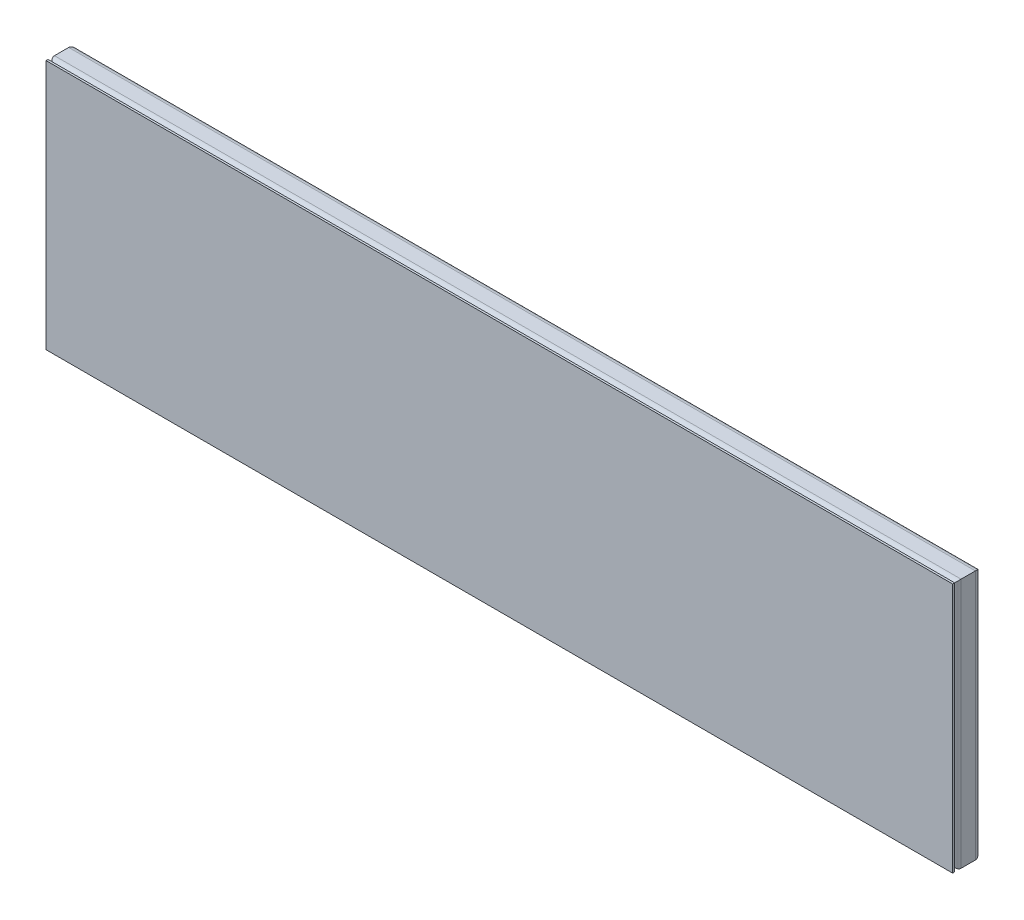
from build123d import *

# Parameters (mm, degrees)
TUBO_CUADRADO_2_X_2_X_0_25_1_DEPTH      = 221.121024484
TUBO_CUADRADO_2_X_2_X_0_25_1_DEPTH_BACK = 36.921024484
TUBO_CUADRADO_2_X_2_X_0_25_1_2_DEPTH    = 873.842048969
TUBO_CUADRADO_2_X_2_X_0_25_1_3_DEPTH    = 258.042048969
TUBO_CUADRADO_2_X_2_X_0_25_1_4_DEPTH    = 873.842048969
CROQUIS3_W                              = 850.8
CROQUIS3_H                              = 235
SALIENTE_EXTRUIR1_DEPTH                 = 1.9


with BuildPart() as part:
    # Sketch1 → Tubo cuadrado 2 X 2 X 0.25(1) (new, two sides: drawn at the far end of the back side and taken through both)
    with BuildSketch(Plane(origin=(-412.7, 92.1, 12.7), x_dir=(1, 0, 0), z_dir=(0, -1, 0)).offset(-TUBO_CUADRADO_2_X_2_X_0_25_1_DEPTH_BACK)):
        with BuildLine():
            Line((-6.7, -12.7), (6.7, -12.7))
            ThreePointArc((6.7, -12.7), (10.942640687, -10.942640687), (12.7, -6.7))
            Line((12.7, -6.7), (12.7, 6.7))
            ThreePointArc((12.7, 6.7), (10.942640687, 10.942640687), (6.7, 12.7))
            Line((6.7, 12.7), (-6.7, 12.7))
            ThreePointArc((-6.7, 12.7), (-10.942640687, 10.942640687), (-12.7, 6.7))
            Line((-12.7, 6.7), (-12.7, -6.7))
            ThreePointArc((-12.7, -6.7), (-10.942640687, -10.942640687), (-6.7, -12.7))
        make_face()
        with BuildLine():
            Line((-6.7, -9.7), (6.7, -9.7))
            ThreePointArc((6.7, -9.7), (8.821320344, -8.821320344), (9.7, -6.7))
            Line((9.7, -6.7), (9.7, 6.7))
            ThreePointArc((9.7, 6.7), (8.821320344, 8.821320344), (6.7, 9.7))
            Line((6.7, 9.7), (-6.7, 9.7))
            ThreePointArc((-6.7, 9.7), (-8.821320344, 8.821320344), (-9.7, 6.7))
            Line((-9.7, 6.7), (-9.7, -6.7))
            ThreePointArc((-9.7, -6.7), (-8.821320344, -8.821320344), (-6.7, -9.7))
        make_face(mode=Mode.SUBTRACT)
    extrude(amount=TUBO_CUADRADO_2_X_2_X_0_25_1_DEPTH + TUBO_CUADRADO_2_X_2_X_0_25_1_DEPTH_BACK)

    # Tubo cuadrado 2 X 2 X 0.25(1) mitre 1
    split(bisect_by=Plane(origin=(-400, 92.1, 0), x_dir=(0.707106781, -0.707106781, 0), z_dir=(-0.707106781, -0.707106781, 0)), keep=Keep.TOP)

    # Tubo cuadrado 2 X 2 X 0.25(1) mitre 2
    split(bisect_by=Plane(origin=(-400, -92.1, 0), x_dir=(-0.707106781, -0.707106781, 0), z_dir=(-0.707106781, 0.707106781, 0)), keep=Keep.TOP)


with BuildPart() as body_2:
    # Sketch1 on segment 2 (carried to segment 2) → Tubo cuadrado 2 X 2 X 0.25_1 2 (new body)
    with BuildSketch(Plane(origin=(-436.921024484, -104.8, 12.7), x_dir=(0, 1, 0), z_dir=(1, 0, 0))):
        with BuildLine():
            Line((-6.7, -12.7), (6.7, -12.7))
            ThreePointArc((6.7, -12.7), (10.942640687, -10.942640687), (12.7, -6.7))
            Line((12.7, -6.7), (12.7, 6.7))
            ThreePointArc((12.7, 6.7), (10.942640687, 10.942640687), (6.7, 12.7))
            Line((6.7, 12.7), (-6.7, 12.7))
            ThreePointArc((-6.7, 12.7), (-10.942640687, 10.942640687), (-12.7, 6.7))
            Line((-12.7, 6.7), (-12.7, -6.7))
            ThreePointArc((-12.7, -6.7), (-10.942640687, -10.942640687), (-6.7, -12.7))
        make_face()
        with BuildLine():
            Line((-6.7, -9.7), (6.7, -9.7))
            ThreePointArc((6.7, -9.7), (8.821320344, -8.821320344), (9.7, -6.7))
            Line((9.7, -6.7), (9.7, 6.7))
            ThreePointArc((9.7, 6.7), (8.821320344, 8.821320344), (6.7, 9.7))
            Line((6.7, 9.7), (-6.7, 9.7))
            ThreePointArc((-6.7, 9.7), (-8.821320344, 8.821320344), (-9.7, 6.7))
            Line((-9.7, 6.7), (-9.7, -6.7))
            ThreePointArc((-9.7, -6.7), (-8.821320344, -8.821320344), (-6.7, -9.7))
        make_face(mode=Mode.SUBTRACT)
    extrude(amount=TUBO_CUADRADO_2_X_2_X_0_25_1_2_DEPTH)

    # Tubo cuadrado 2 X 2 X 0.25_1 2 mitre 1
    split(bisect_by=Plane(origin=(-400, -92.1, 0), x_dir=(0.707106781, 0.707106781, 0), z_dir=(0.707106781, -0.707106781, 0)), keep=Keep.TOP)

    # Tubo cuadrado 2 X 2 X 0.25_1 2 mitre 2
    split(bisect_by=Plane(origin=(400, -92.1, 0), x_dir=(0.707106781, -0.707106781, 0), z_dir=(-0.707106781, -0.707106781, 0)), keep=Keep.TOP)


with BuildPart() as body_3:
    # Sketch1 on segment 3 (carried to segment 3) → Tubo cuadrado 2 X 2 X 0.25_1 3 (new body)
    with BuildSketch(Plane(origin=(412.7, -129.021024484, 12.7), x_dir=(-1, 0, 0), z_dir=(0, 1, 0))):
        with BuildLine():
            Line((-6.7, -12.7), (6.7, -12.7))
            ThreePointArc((6.7, -12.7), (10.942640687, -10.942640687), (12.7, -6.7))
            Line((12.7, -6.7), (12.7, 6.7))
            ThreePointArc((12.7, 6.7), (10.942640687, 10.942640687), (6.7, 12.7))
            Line((6.7, 12.7), (-6.7, 12.7))
            ThreePointArc((-6.7, 12.7), (-10.942640687, 10.942640687), (-12.7, 6.7))
            Line((-12.7, 6.7), (-12.7, -6.7))
            ThreePointArc((-12.7, -6.7), (-10.942640687, -10.942640687), (-6.7, -12.7))
        make_face()
        with BuildLine():
            Line((-6.7, -9.7), (6.7, -9.7))
            ThreePointArc((6.7, -9.7), (8.821320344, -8.821320344), (9.7, -6.7))
            Line((9.7, -6.7), (9.7, 6.7))
            ThreePointArc((9.7, 6.7), (8.821320344, 8.821320344), (6.7, 9.7))
            Line((6.7, 9.7), (-6.7, 9.7))
            ThreePointArc((-6.7, 9.7), (-8.821320344, 8.821320344), (-9.7, 6.7))
            Line((-9.7, 6.7), (-9.7, -6.7))
            ThreePointArc((-9.7, -6.7), (-8.821320344, -8.821320344), (-6.7, -9.7))
        make_face(mode=Mode.SUBTRACT)
    extrude(amount=TUBO_CUADRADO_2_X_2_X_0_25_1_3_DEPTH)

    # Tubo cuadrado 2 X 2 X 0.25_1 3 mitre 1
    split(bisect_by=Plane(origin=(400, 92.1, 0), x_dir=(0.707106781, 0.707106781, 0), z_dir=(0.707106781, -0.707106781, 0)), keep=Keep.TOP)

    # Tubo cuadrado 2 X 2 X 0.25_1 3 mitre 2
    split(bisect_by=Plane(origin=(400, -92.1, 0), x_dir=(-0.707106781, 0.707106781, 0), z_dir=(0.707106781, 0.707106781, 0)), keep=Keep.TOP)


with BuildPart() as body_4:
    # Sketch1 on segment 4 (carried to segment 4) → Tubo cuadrado 2 X 2 X 0.25_1 4 (new body)
    with BuildSketch(Plane(origin=(436.921024484, 104.8, 12.7), x_dir=(0, -1, 0), z_dir=(-1, 0, 0))):
        with BuildLine():
            Line((-6.7, -12.7), (6.7, -12.7))
            ThreePointArc((6.7, -12.7), (10.942640687, -10.942640687), (12.7, -6.7))
            Line((12.7, -6.7), (12.7, 6.7))
            ThreePointArc((12.7, 6.7), (10.942640687, 10.942640687), (6.7, 12.7))
            Line((6.7, 12.7), (-6.7, 12.7))
            ThreePointArc((-6.7, 12.7), (-10.942640687, 10.942640687), (-12.7, 6.7))
            Line((-12.7, 6.7), (-12.7, -6.7))
            ThreePointArc((-12.7, -6.7), (-10.942640687, -10.942640687), (-6.7, -12.7))
        make_face()
        with BuildLine():
            Line((-6.7, -9.7), (6.7, -9.7))
            ThreePointArc((6.7, -9.7), (8.821320344, -8.821320344), (9.7, -6.7))
            Line((9.7, -6.7), (9.7, 6.7))
            ThreePointArc((9.7, 6.7), (8.821320344, 8.821320344), (6.7, 9.7))
            Line((6.7, 9.7), (-6.7, 9.7))
            ThreePointArc((-6.7, 9.7), (-8.821320344, 8.821320344), (-9.7, 6.7))
            Line((-9.7, 6.7), (-9.7, -6.7))
            ThreePointArc((-9.7, -6.7), (-8.821320344, -8.821320344), (-6.7, -9.7))
        make_face(mode=Mode.SUBTRACT)
    extrude(amount=TUBO_CUADRADO_2_X_2_X_0_25_1_4_DEPTH)

    # Tubo cuadrado 2 X 2 X 0.25_1 4 mitre 1
    split(bisect_by=Plane(origin=(-400, 92.1, 0), x_dir=(-0.707106781, 0.707106781, 0), z_dir=(0.707106781, 0.707106781, 0)), keep=Keep.TOP)

    # Tubo cuadrado 2 X 2 X 0.25_1 4 mitre 2
    split(bisect_by=Plane(origin=(400, 92.1, 0), x_dir=(-0.707106781, -0.707106781, 0), z_dir=(-0.707106781, 0.707106781, 0)), keep=Keep.TOP)


with BuildPart() as body_5:
    # Croquis3 → Saliente-Extruir1 (new body)
    with BuildSketch(Plane.XY.offset(25.4)):
        Rectangle(CROQUIS3_W, CROQUIS3_H)
    extrude(amount=SALIENTE_EXTRUIR1_DEPTH)


solid = Compound([part.part, body_2.part, body_3.part, body_4.part, body_5.part])
